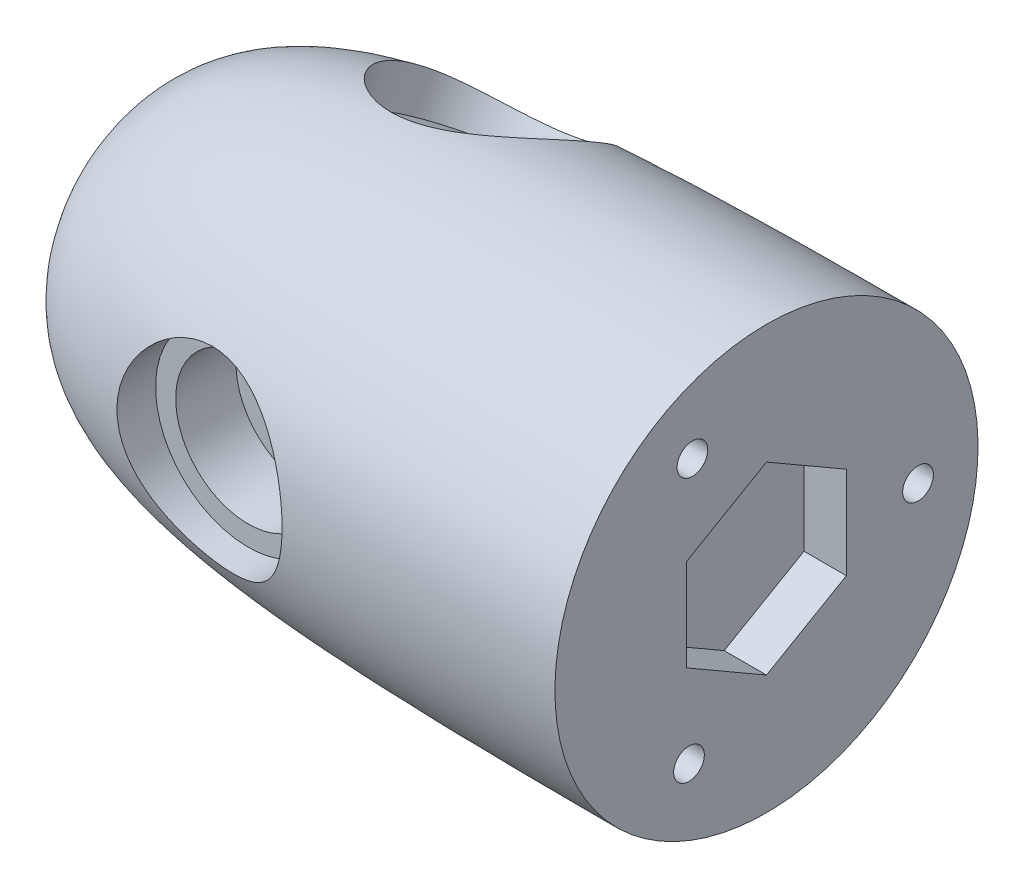
from build123d import *

# Parameters (mm, degrees)
SKETCH3_R          = 0.685
CUT_EXTRUDE1_DEPTH = 1.17
SKETCH4_R          = 0.875
CUT_EXTRUDE2_DEPTH = 0.6
CIRPATTERN1_COUNT  = 3
SCALE1_SCALE       = 10
CUT_EXTRUDE3_DEPTH = 4
SKETCH8_R          = 1.45
CUT_EXTRUDE4_DEPTH = 10


with BuildPart() as part:
    # Sketch1 → Revolve1 (revolve)
    with BuildSketch(Plane.XY):
        with BuildLine():
            Line((0, 0), (-6, 0))
            add(Edge.make_bspline(
                [(-6, 0), (-6, 1.777820911), (-4.715943748, 2), (0, 2)],
                knots=[0, 0, 0, 0, 1, 1, 1, 1], degree=3))
            Line((0, 2), (0, 0))
        make_face()
    revolve(axis=Axis((0, 0, 0), (-1, 0, 0)))

    # Sketch3 → Cut-Extrude1 (cut)
    with BuildSketch(Plane.XY.offset(2)):
        with Locations((-3.5, 0)):
            Circle(SKETCH3_R)
    cut_extrude1 = extrude(amount=-CUT_EXTRUDE1_DEPTH, mode=Mode.SUBTRACT)

    # Sketch4 → Cut-Extrude2 (cut)
    with BuildSketch(Plane.XY.offset(2)):
        with Locations((-3.5, 0)):
            Circle(SKETCH4_R)
    cut_extrude2 = extrude(amount=-CUT_EXTRUDE2_DEPTH, mode=Mode.SUBTRACT)

    # CirPattern1: Cut-Extrude1, Cut-Extrude2 ×3 about axis
    cirpattern1_axis = Axis((0, 0, 0), (1, 0, 0))
    add([cut_extrude1.rotate(cirpattern1_axis, i * 360 / CIRPATTERN1_COUNT) for i in range(1, CIRPATTERN1_COUNT)], mode=Mode.SUBTRACT)
    add([cut_extrude2.rotate(cirpattern1_axis, i * 360 / CIRPATTERN1_COUNT) for i in range(1, CIRPATTERN1_COUNT)], mode=Mode.SUBTRACT)


with BuildPart() as part_1:
    # Scale1: scaled about (-2.513849937, -2.1e-08, 6.5e-08)
    add(part.part.scale(SCALE1_SCALE).moved(Location((22.624649433, 1.89e-07, -5.85e-07))))

    # Sketch7 → Cut-Extrude3 (cut)
    with BuildSketch(Plane(origin=(22.625249359, 0, 0), x_dir=(0, 0, -1), z_dir=(1, 0, 0))):
        Polygon((0, 8.717989065), (-7.55, 4.358994532), (-7.55, -4.358994532), (0, -8.717989065), (7.55, -4.358994532), (7.55, 4.358994532), align=None)
    extrude(amount=-CUT_EXTRUDE3_DEPTH, mode=Mode.SUBTRACT)

    # Sketch8 → Cut-Extrude4 (cut)
    with BuildSketch(Plane(origin=(22.625249359, 0, 0), x_dir=(0, 0, -1), z_dir=(1, 0, 0))):
        with Locations(Location((-7, 12.5, 0), (0, 0, 90))):
            Circle(SKETCH8_R)
        with Locations(Location((14.325317547, -0.187822174, 0), (0, 0, 90))):
            Circle(SKETCH8_R)
        with Locations(Location((-7.325317547, -12.312177826, 0), (0, 0, 90))):
            Circle(SKETCH8_R)
    extrude(amount=-CUT_EXTRUDE4_DEPTH, mode=Mode.SUBTRACT)


solid = part_1.part
